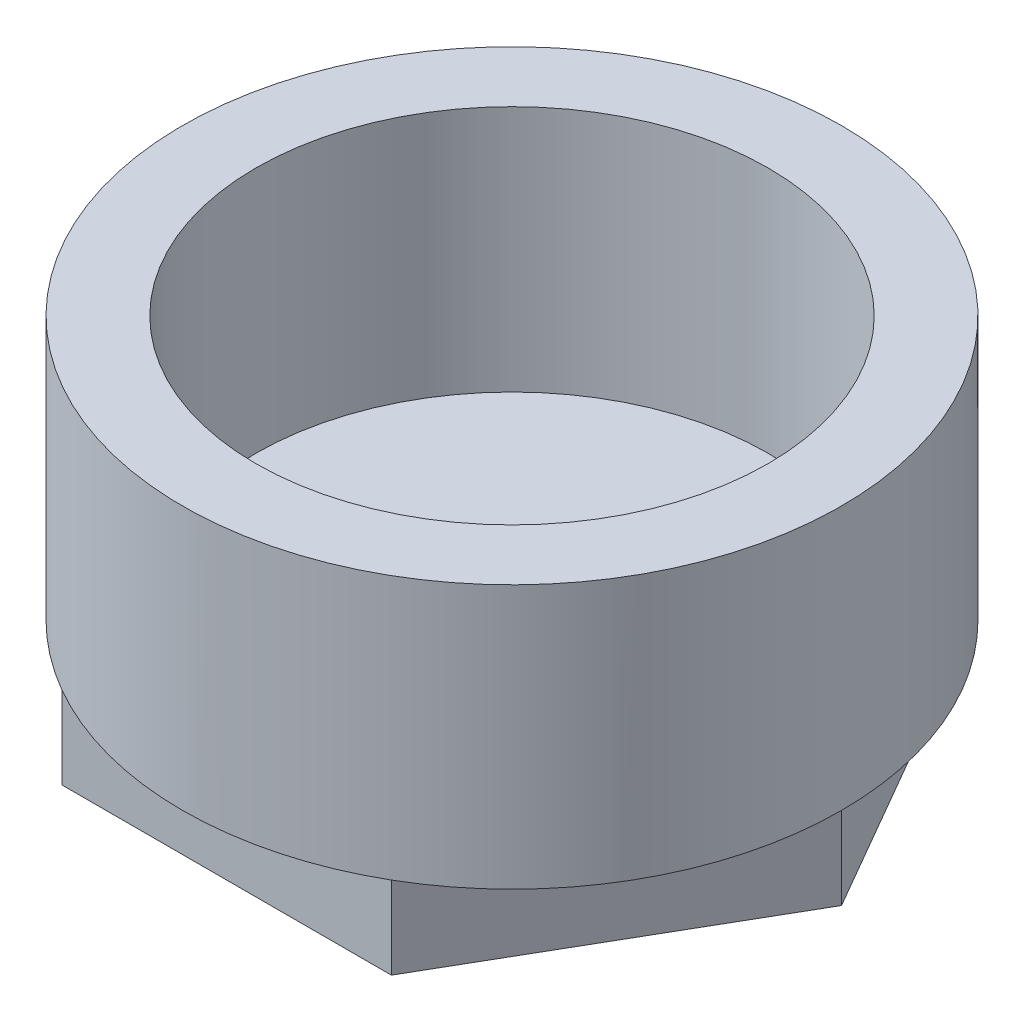
from build123d import *

# Parameters (mm, degrees)
SCHIZZO2_R               = 3.175
SCHIZZO2_R_2             = 0.5
TAGLIO_ESTRUSIONE1_DEPTH = 10
TAGLIO_ESTRUSIONE2_START = -5
TAGLIO_ESTRUSIONE2_DEPTH = 5


with BuildPart() as part:
    # Schizzo1 → Rivoluzione1 (revolve)
    with BuildSketch(Plane.XY, mode=Mode.PRIVATE) as rivoluzione1_sk:
        Polygon((0, 0), (-20, 0), (-20, 21), (-15.5465, 21), (-15.5465, 6), (0, 6), align=None)
    revolve(rivoluzione1_sk.sketch.rotate(Axis((0, 0, 0), (0, 1, 0)), 270), axis=Axis((0, 0, 0), (0, 1, 0)))

    # Schizzo2 → Taglio-Estrusione1 (cut)
    with BuildSketch(Plane.XZ):
        with Locations(Location((0, 0, 0), (0, 0, 270))):
            Circle(SCHIZZO2_R)
        with Locations(Location((10, 0, 0), (0, 0, 270))):
            Circle(SCHIZZO2_R_2)
    extrude(amount=-TAGLIO_ESTRUSIONE1_DEPTH, mode=Mode.SUBTRACT)

    # Schizzo5 → Taglio-Estrusione2 (cut)
    with BuildSketch(Plane(origin=(0, 0, 0), x_dir=(-1, 0, 0), z_dir=(0, -1, 0)).offset(TAGLIO_ESTRUSIONE2_START)):
        with BuildLine():
            Line((-10, 17.320508076), (10, 17.320508076))
            ThreePointArc((10, 17.320508076), (0, 20), (-10, 17.320508076))
        make_face()
        with BuildLine():
            ThreePointArc((20, 0), (17.320508076, 10), (10, 17.320508076))
            Line((10, 17.320508076), (20, 0))
        make_face()
        with BuildLine():
            ThreePointArc((10, -17.320508076), (17.320508076, -10), (20, 0))
            Line((20, 0), (10, -17.320508076))
        make_face()
        with BuildLine():
            ThreePointArc((-10, -17.320508076), (0, -20), (10, -17.320508076))
            Line((10, -17.320508076), (-10, -17.320508076))
        make_face()
        with BuildLine():
            Line((-10, -17.320508076), (-20, 0))
            ThreePointArc((-20, 0), (-17.320508076, -10), (-10, -17.320508076))
        make_face()
        with BuildLine():
            Line((-20, 0), (-10, 17.320508076))
            ThreePointArc((-10, 17.320508076), (-17.320508076, 10), (-20, 0))
        make_face()
    extrude(amount=TAGLIO_ESTRUSIONE2_DEPTH, mode=Mode.SUBTRACT)


solid = part.part
